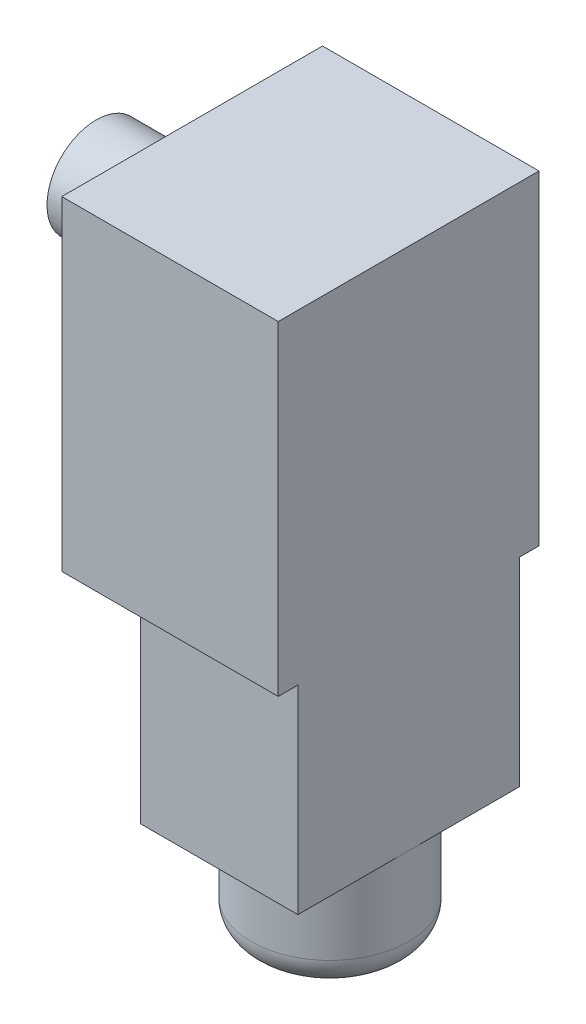
from build123d import *

# Parameters (mm, degrees)
ESBO_O1_W                = 20
ESBO_O1_H                = 64.2
RESSALTO_EXTRUS_O1_DEPTH = 22.5
ESBO_O2_W                = 22.5
ESBO_O2_H                = 32.994304237
RESSALTO_EXTRUS_O2_DEPTH = 2
ESBO_O3_W                = 22
ESBO_O3_H                = 32.994304237
RESSALTO_EXTRUS_O3_DEPTH = 2
ESBO_O4_W                = 22
ESBO_O4_H                = 32.994304237
RESSALTO_EXTRUS_O5_DEPTH = 2
ESBO_O5_W                = 22.5
ESBO_O5_H                = 31.205695763
CORTE_EXTRUS_O1_DEPTH    = 4
RESSALTO_EXTRUS_O6_DEPTH = 20
CORTE_EXTRUS_O2_DEPTH    = 11
FILETE1_R                = 3
ESBO_O10_R               = 5
RESSALTO_EXTRUS_O7_DEPTH = 10


with BuildPart() as part:
    # Esboço1 → Ressalto-extrusão1 (new body)
    with BuildSketch(Plane.XY):
        with Locations((-32.828798315, -45.771841795)):
            Rectangle(ESBO_O1_W, ESBO_O1_H)
    extrude(amount=RESSALTO_EXTRUS_O1_DEPTH)

    # Esboço2 → Ressalto-extrusão2 (add)
    with BuildSketch(Plane.ZY.offset(42.828798315)):
        with Locations((11.25, -30.168993913)):
            Rectangle(ESBO_O2_W, ESBO_O2_H)
    extrude(amount=RESSALTO_EXTRUS_O2_DEPTH)

    # Esboço3 → Ressalto-extrusão3 (add)
    with BuildSketch(Plane(origin=(0, 0, 0), x_dir=(-1, 0, 0), z_dir=(0, 0, -1))):
        with Locations((33.828798315, -30.168993913)):
            Rectangle(ESBO_O3_W, ESBO_O3_H)
    extrude(amount=RESSALTO_EXTRUS_O3_DEPTH)

    # Esboço4 → Ressalto-extrusão5 (add)
    with BuildSketch(Plane.XY.offset(22.5)):
        with Locations((-33.828798315, -30.168993913)):
            Rectangle(ESBO_O4_W, ESBO_O4_H)
    extrude(amount=RESSALTO_EXTRUS_O5_DEPTH)

    # Esboço5 → Corte-extrusão1 (cut)
    with BuildSketch(Plane.ZY.offset(42.828798315)):
        with Locations((11.25, -62.268993914)):
            Rectangle(ESBO_O5_W, ESBO_O5_H)
    extrude(amount=-CORTE_EXTRUS_O1_DEPTH, mode=Mode.SUBTRACT)

    # Esboço8 → Ressalto-extrusão6 (add)
    with BuildSketch(Plane.XZ.offset(46.666146032)):
        with BuildLine():
            Line((-38.828798315, 0), (-38.828798315, 22.5))
            ThreePointArc((-38.828798315, 22.5), (-43.488700892, 11.25), (-38.828798315, 0))
        make_face()
    extrude(amount=RESSALTO_EXTRUS_O6_DEPTH)

    # Esboço9 → Corte-extrusão2 (cut)
    with BuildSketch(Plane(origin=(0, -77.871841795, 0), x_dir=(-1, 0, 0), z_dir=(0, -1, 0))):
        with BuildLine():
            Line((38.828798315, -22.5), (38.828798315, -11.25))
            ThreePointArc((38.828798315, -11.25), (30.828798315, -19.25), (22.828798315, -11.25))
            Line((22.828798315, -11.25), (22.828798315, -22.5))
            Line((22.828798315, -22.5), (38.828798315, -22.5))
        make_face()
        with BuildLine():
            Line((38.828798315, -11.25), (38.828798315, 0))
            Line((38.828798315, 0), (22.828798315, 0))
            Line((22.828798315, 0), (22.828798315, -11.25))
            ThreePointArc((22.828798315, -11.25), (30.828798315, -3.25), (38.828798315, -11.25))
        make_face()
    extrude(amount=-CORTE_EXTRUS_O2_DEPTH, mode=Mode.SUBTRACT)

    # Filete1
    filete1_edges = [part.edges().sort_by_distance(p)[0] for p in [
        (-22.828798315, -77.871841795, 11.25),
    ]]
    fillet(filete1_edges, radius=FILETE1_R)

    # Esboço10 → Ressalto-extrusão7 (add)
    with BuildSketch(Plane.ZY.offset(44.828798315)):
        with Locations(Location((11, -23.671841795, 0), (0, 0, 90))):
            Circle(ESBO_O10_R)
    extrude(amount=RESSALTO_EXTRUS_O7_DEPTH)


solid = part.part
